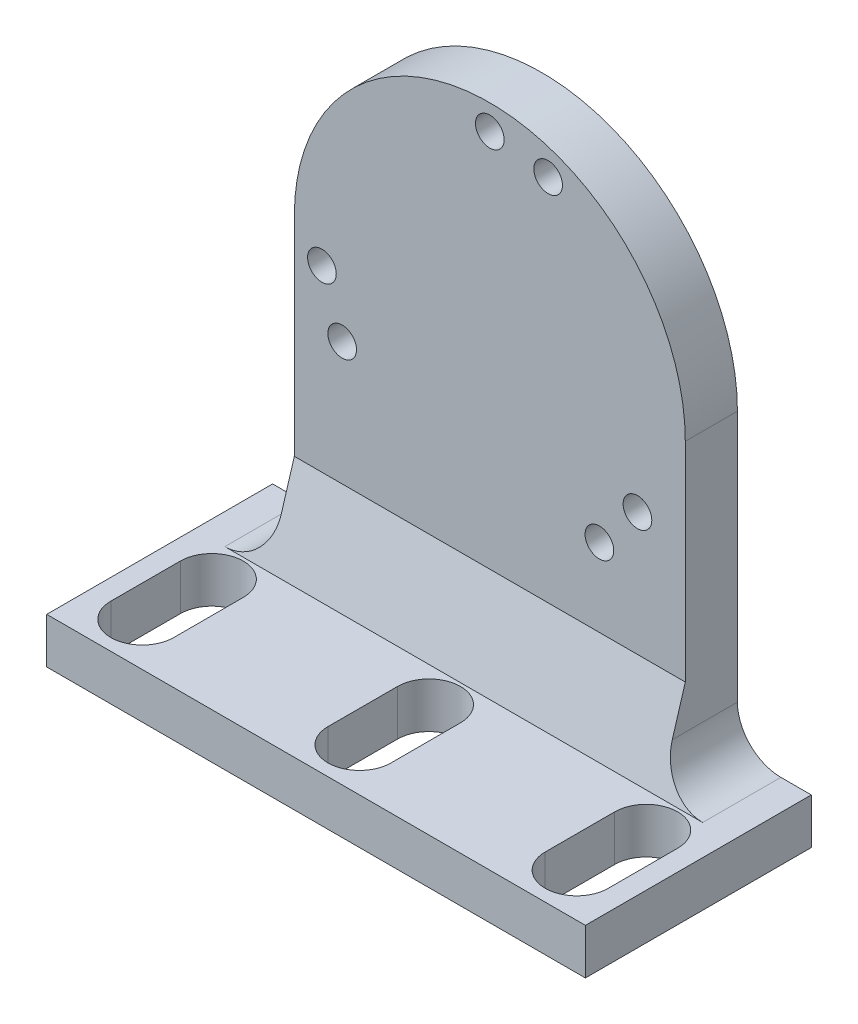
from build123d import *

# Parameters (mm, degrees)
SKETCH_1_R          = 1.65
EXTRUDE_1_DEPTH     = 6
SKETCH_2_W          = 62
SKETCH_2_H          = 5.25
EXTRUDE_2_DEPTH     = 26
CUT_EXTRUDE_1_DEPTH = 70.492805383
EXTRUDE_3_DEPTH     = 22.5
FILLET_1_R          = 5


with BuildPart() as part:
    # 스케치1 → 보스-돌출1 (new body)
    with BuildSketch(Plane.XY):
        with BuildLine():
            ThreePointArc((-22.5, 0), (0, 22.5), (22.5, 0))
            Line((22.5, 0), (22.5, -34))
            Line((22.5, -34), (-22.5, -34))
            Line((-22.5, -34), (-22.5, 0))
        make_face()
        with Locations((-19.32389773, -3.407324542)):
            Circle(SKETCH_1_R, mode=Mode.SUBTRACT)
        with Locations((16.993150473, -9.811)):
            Circle(SKETCH_1_R, mode=Mode.SUBTRACT)
        with Locations((6.711119252, 18.438648605)):
            Circle(SKETCH_1_R, mode=Mode.SUBTRACT)
        with Locations((0, 19.622)):
            Circle(SKETCH_1_R, mode=Mode.SUBTRACT)
        with Locations((12.612778477, -15.031324063)):
            Circle(SKETCH_1_R, mode=Mode.SUBTRACT)
        with Locations((-16.993150473, -9.811)):
            Circle(SKETCH_1_R, mode=Mode.SUBTRACT)
    extrude(amount=EXTRUDE_1_DEPTH)

    # 스케치2 → 보스-돌출2 (add)
    with BuildSketch(Plane.XY):
        with Locations((0, -36.625)):
            Rectangle(SKETCH_2_W, SKETCH_2_H)
    extrude(amount=EXTRUDE_2_DEPTH)

    # 스케치3 → 컷-돌출1 (cut, through all)
    with BuildSketch(Plane(origin=(0, -34, 0), x_dir=(1, 0, 0), z_dir=(0, 1, 0))):
        with BuildLine():
            Line((-3.625, -21), (-3.625, -13))
            ThreePointArc((-3.625, -13), (0, -9.375), (3.625, -13))
            Line((3.625, -13), (3.625, -21))
            ThreePointArc((3.625, -21), (0, -24.625), (-3.625, -21))
        make_face()
        with BuildLine():
            Line((21.375, -21), (21.375, -13))
            ThreePointArc((21.375, -13), (25, -9.375), (28.625, -13))
            Line((28.625, -13), (28.625, -21))
            ThreePointArc((28.625, -21), (25, -24.625), (21.375, -21))
        make_face()
        with BuildLine():
            Line((-28.625, -21), (-28.625, -13))
            ThreePointArc((-28.625, -13), (-25, -9.375), (-21.375, -13))
            Line((-21.375, -13), (-21.375, -21))
            ThreePointArc((-21.375, -21), (-25, -24.625), (-28.625, -21))
        make_face()
    extrude(amount=-CUT_EXTRUDE_1_DEPTH, mode=Mode.SUBTRACT)

    # 스케치4 → 보스-돌출3 (add, symmetric)
    with BuildSketch(Plane(origin=(0, 0, 0), x_dir=(0, 0, -1), z_dir=(1, 0, 0))):
        Polygon((-6, -24), (-9, -34), (-6, -34), align=None)
    extrude(amount=EXTRUDE_3_DEPTH, both=True)

    # 필렛1
    fillet_1_edges = [part.edges().sort_by_distance(p)[0] for p in [
        (22.5, -34, 4.5),
        (-22.5, -34, 4.5),
    ]]
    fillet(fillet_1_edges, radius=FILLET_1_R)


solid = part.part
